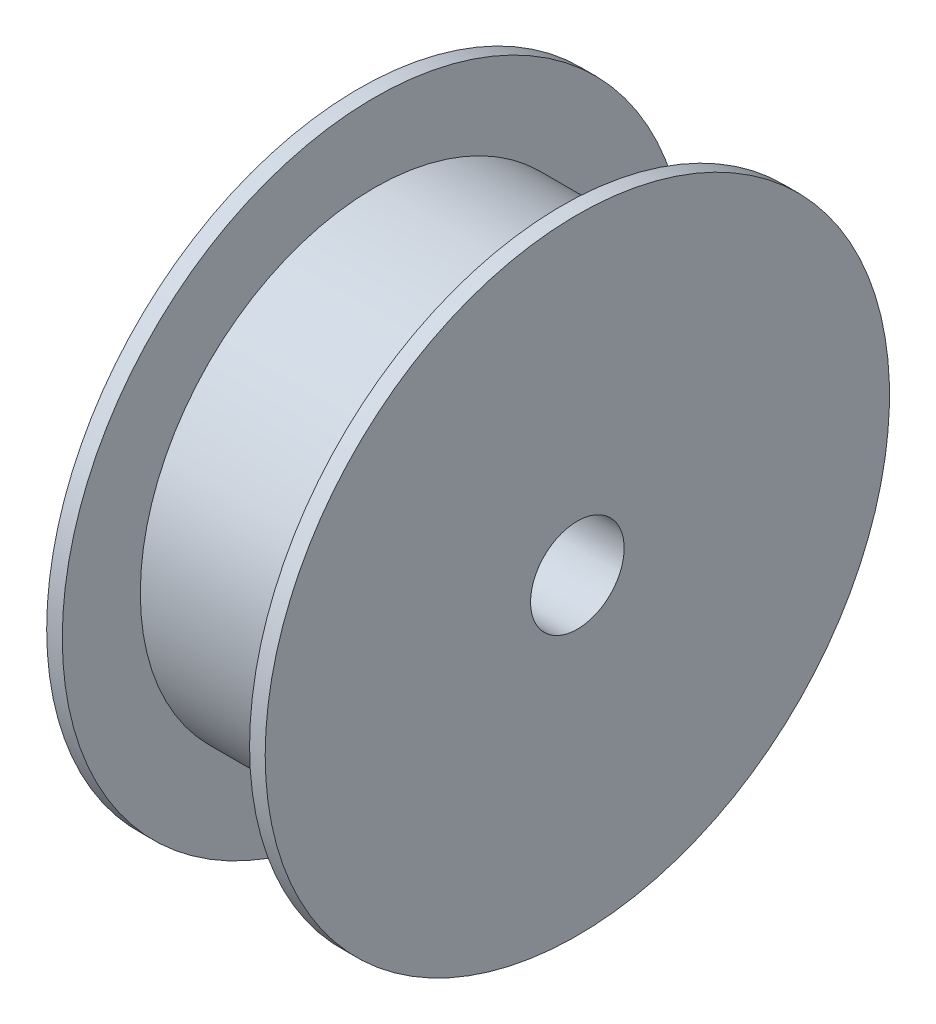
from build123d import *

# Parameters (mm, degrees)
SKETCH_3_R          = 1.6
CUT_EXTRUDE_1_DEPTH = 64.287719075


with BuildPart() as part:
    # ｽｹｯﾁ2 → 回転1 (revolve)
    with BuildSketch(Plane(origin=(0, 0, 0), x_dir=(1, 0, 0), z_dir=(0, 1, 0)), mode=Mode.PRIVATE) as revolve_1_sk:
        Polygon((-44.73085458, -0.056036178), (-44.73085458, -17.056036178), (-30.73085458, -17.056036178), (-30.73085458, -0.056036178), (-31.73085458, -0.056036178), (-31.73085458, -5.056036178), (-43.73085458, -5.056036178), (-43.73085458, -0.056036178), align=None)
    revolve(revolve_1_sk.sketch.rotate(Axis((-49.849406884, 0, 20.056036178), (1, 0, 0)), 180), axis=Axis((-49.849406884, 0, 20.056036178), (1, 0, 0)))

    # ｽｹｯﾁ3 → ｶｯﾄ - 押し出し1 (cut, through all)
    with BuildSketch(Plane(origin=(0, 0, 0), x_dir=(1, 0, 0), z_dir=(0, 1, 0))):
        with Locations(Location((-37.73085458, -20.056036178, 0), (0, 0, 270))):
            Circle(SKETCH_3_R)
    extrude(amount=-CUT_EXTRUDE_1_DEPTH, mode=Mode.SUBTRACT)


solid = part.part
